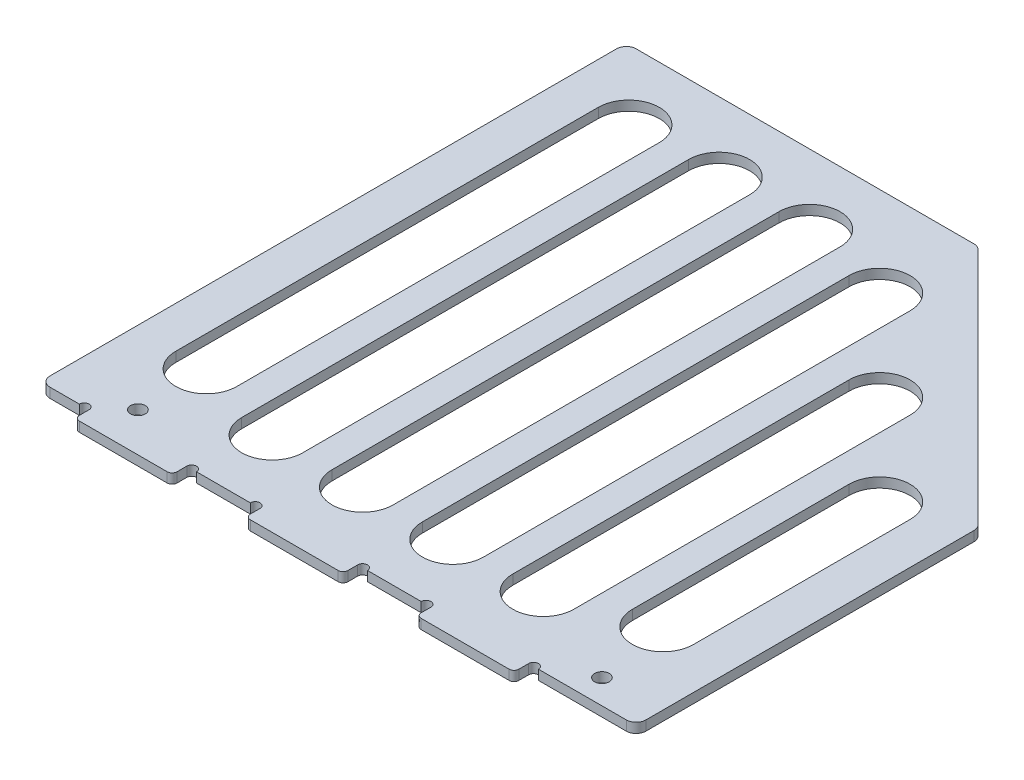
from build123d import *

# Parameters (mm, degrees)
SKETCH_1_R          = 1.5
EXTRUDE_1_DEPTH     = 2
SKETCH_2_R          = 1
CUT_EXTRUDE_1_DEPTH = 172.137371722
CUT_EXTRUDE_2_DEPTH = 172.137371722
FILLET_1_R          = 2
FILLET_2_R          = 1


with BuildPart() as part:
    # 草图1 → 凸台-拉伸1 (new body)
    with BuildSketch(Plane(origin=(0, 0, 0), x_dir=(1, 0, 0), z_dir=(0, 1, 0))):
        Polygon((0, 0), (0, 70), (-50, 120), (-122, 120), (-122, 0), (-112, 0), (-112, -3), (-92, -3), (-92, 0), (-77, 0), (-77, -3), (-57, -3), (-57, 0), (-42, 0), (-42, -3), (-22, -3), (-22, 0), align=None)
        with Locations(Location((-12, 5, 0), (0, 0, 270))):
            Circle(SKETCH_1_R, mode=Mode.SUBTRACT)
        with Locations(Location((-107, 5, 0), (0, 0, 270))):
            Circle(SKETCH_1_R, mode=Mode.SUBTRACT)
    extrude(amount=EXTRUDE_1_DEPTH)

    # 草图2 → 切除-拉伸1 (cut, through all)
    with BuildSketch(Plane(origin=(0, 2, 0), x_dir=(1, 0, 0), z_dir=(0, 1, 0))):
        with Locations((-113, 0)):
            Circle(SKETCH_2_R)
        with Locations((-91, 0)):
            Circle(SKETCH_2_R)
        with Locations((-78, 0)):
            Circle(SKETCH_2_R)
        with Locations((-56, 0)):
            Circle(SKETCH_2_R)
        with Locations((-43, 0)):
            Circle(SKETCH_2_R)
        with Locations((-21, 0)):
            Circle(SKETCH_2_R)
    extrude(amount=-CUT_EXTRUDE_1_DEPTH, mode=Mode.SUBTRACT)

    # 草图3 → 切除-拉伸2 (cut, through all)
    with BuildSketch(Plane(origin=(0, 2, 0), x_dir=(1, 0, 0), z_dir=(0, 1, 0))):
        with BuildLine():
            Line((-101, 105.75), (-101, 19.25))
            ThreePointArc((-101, 19.25), (-107.25, 13), (-113.5, 19.25))
            Line((-113.5, 19.25), (-113.5, 105.75))
            ThreePointArc((-113.5, 105.75), (-107.25, 112), (-101, 105.75))
        make_face()
        with BuildLine():
            Line((-82.5, 105.75), (-82.5, 14.25))
            ThreePointArc((-82.5, 14.25), (-88.75, 8), (-95, 14.25))
            Line((-95, 14.25), (-95, 105.75))
            ThreePointArc((-95, 105.75), (-88.75, 112), (-82.5, 105.75))
        make_face()
        with BuildLine():
            Line((-64, 105.75), (-64, 14.25))
            ThreePointArc((-64, 14.25), (-70.25, 8), (-76.5, 14.25))
            Line((-76.5, 14.25), (-76.5, 105.75))
            ThreePointArc((-76.5, 105.75), (-70.25, 112), (-64, 105.75))
        make_face()
        with BuildLine():
            Line((-45.5, 101.597456736), (-45.5, 14.25))
            ThreePointArc((-45.5, 14.25), (-51.75, 8), (-58, 14.25))
            Line((-58, 14.25), (-58, 101.597456736))
            ThreePointArc((-58, 101.597456736), (-51.75, 107.847456736), (-45.5, 101.597456736))
        make_face()
        with BuildLine():
            Line((-27, 83.097456736), (-27, 14.25))
            ThreePointArc((-27, 14.25), (-33.25, 8), (-39.5, 14.25))
            Line((-39.5, 14.25), (-39.5, 83.097456736))
            ThreePointArc((-39.5, 83.097456736), (-33.25, 89.347456736), (-27, 83.097456736))
        make_face()
        with BuildLine():
            Line((-8.5, 64.597456736), (-8.5, 20.25))
            ThreePointArc((-8.5, 20.25), (-14.75, 14), (-21, 20.25))
            Line((-21, 20.25), (-21, 64.597456736))
            ThreePointArc((-21, 64.597456736), (-14.75, 70.847456736), (-8.5, 64.597456736))
        make_face()
    extrude(amount=-CUT_EXTRUDE_2_DEPTH, mode=Mode.SUBTRACT)

    # 圆角1
    fillet_1_edges = [part.edges().sort_by_distance(p)[0] for p in [
        (-122, 1, 0),
        (-122, 1, -120),
        (-50, 1, -120),
        (0, 1, -70),
        (0, 1, 0),
    ]]
    fillet(fillet_1_edges, radius=FILLET_1_R)

    # 圆角2
    fillet_2_edges = [part.edges().sort_by_distance(p)[0] for p in [
        (-22, 1, 3),
        (-42, 1, 3),
        (-57, 1, 3),
        (-77, 1, 3),
        (-92, 1, 3),
        (-112, 1, 3),
    ]]
    fillet(fillet_2_edges, radius=FILLET_2_R)


solid = part.part
